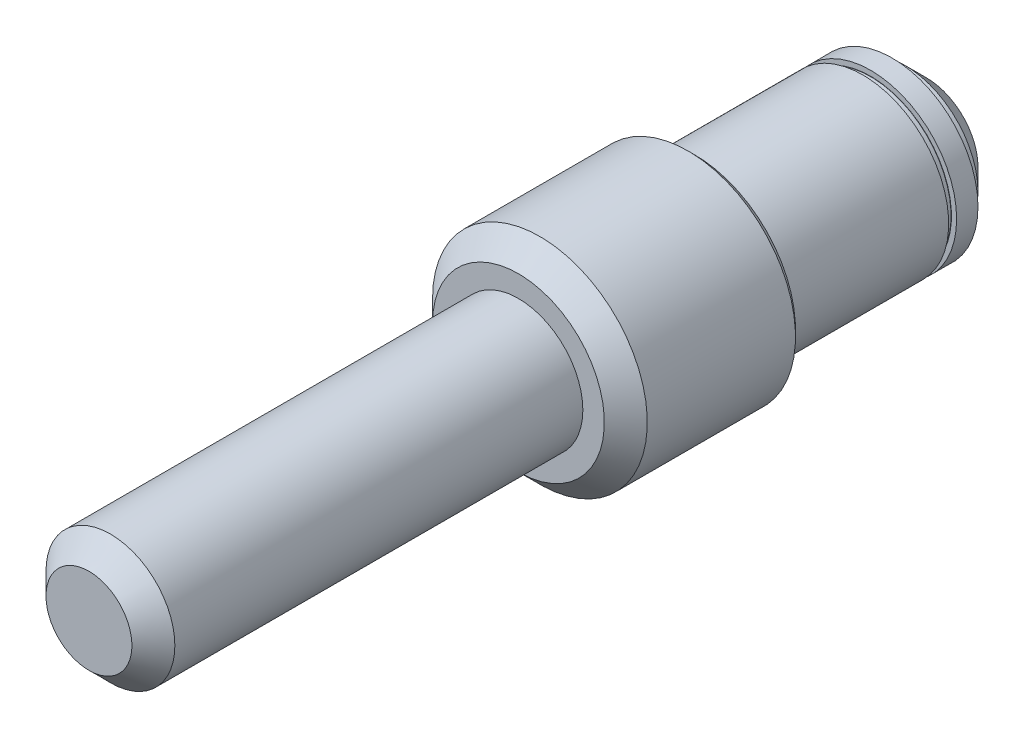
from build123d import *

# Parameters (mm, degrees)
CHAMFER_1_SIZE      = 5
SKETCH_4_R          = 20
SKETCH_4_R_2        = 18.75
CUT_EXTRUDE_1_DEPTH = 1.85
FILLET_1_R          = 0.05
CHAMFER_2_SIZE      = 1.5
SKETCH_9_R          = 25
SKETCH_9_R_2        = 20
CUT_EXTRUDE_4_DEPTH = 6
CHAMFER_3_SIZE      = 1.5


with BuildPart() as part:
    # Эскиз1 → Повернуть1 (revolve)
    with BuildSketch(Plane(origin=(0, 0, 0), x_dir=(0, 0, -1), z_dir=(1, 0, 0))):
        Polygon((0, 0), (0, 15), (100, 15), (100, 25), (147, 25), (147, 20), (187, 20), (187, 17), (195, 17), (195, 5), (190, 0), align=None)
    revolve(axis=Axis((0, 0, 0), (0, 0, -1)))

    # Фаска1
    chamfer_1_edges = [part.edges().sort_by_distance(p)[0] for p in [
        (0, -25, -100),
        (0, -15, 0),
        (0, -17, -195),
    ]]
    chamfer(chamfer_1_edges, length=CHAMFER_1_SIZE)

    # Эскиз4 → Вырез-Вытянуть1 (cut)
    with BuildSketch(Plane(origin=(0, 0, -182.025), x_dir=(-1, 0, 0), z_dir=(0, 0, -1))):
        Circle(SKETCH_4_R)
        Circle(SKETCH_4_R_2, mode=Mode.SUBTRACT)
    extrude(amount=-CUT_EXTRUDE_1_DEPTH, mode=Mode.SUBTRACT)

    # Скругление1
    fillet_1_edges = [part.edges().sort_by_distance(p)[0] for p in [
        (18.75, 0, -180.175),
        (18.75, 0, -182.025),
    ]]
    fillet(fillet_1_edges, radius=FILLET_1_R)

    # Фаска2
    chamfer_2_edges = [part.edges().sort_by_distance(p)[0] for p in [
        (0, -25, -147),
    ]]
    chamfer(chamfer_2_edges, length=CHAMFER_2_SIZE)

    # Эскиз9 → Вырез-Вытянуть4 (cut)
    with BuildSketch(Plane(origin=(0, 0, -147), x_dir=(-1, 0, 0), z_dir=(0, 0, -1))):
        Circle(SKETCH_9_R)
        Circle(SKETCH_9_R_2, mode=Mode.SUBTRACT)
    extrude(amount=-CUT_EXTRUDE_4_DEPTH, mode=Mode.SUBTRACT)

    # Фаска3
    chamfer_3_edges = [part.edges().sort_by_distance(p)[0] for p in [
        (0, -25, -141),
    ]]
    chamfer(chamfer_3_edges, length=CHAMFER_3_SIZE)


solid = part.part
